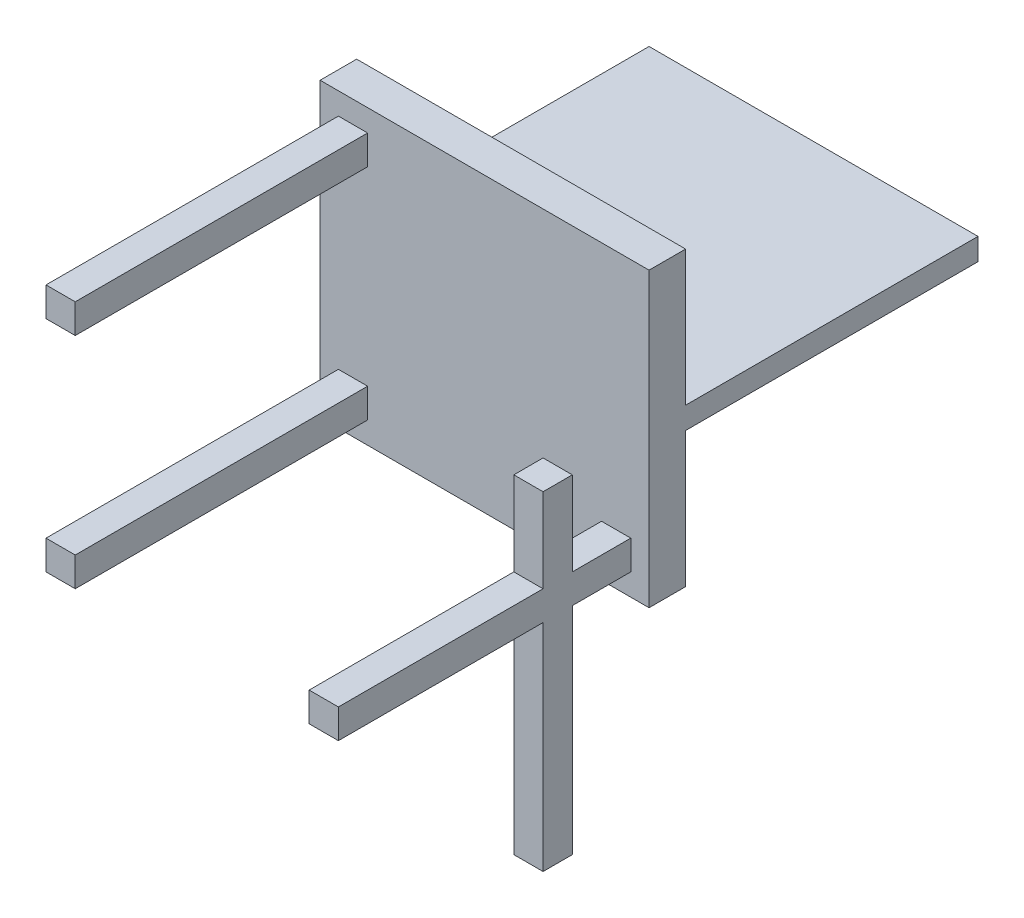
from build123d import *

# Parameters (mm, degrees)
SKETCH_1_W      = 450
SKETCH_1_H      = 400
EXTRUDE_1_DEPTH = 50
SKETCH_2_W      = 450
SKETCH_2_H      = 30
EXTRUDE_2_DEPTH = 400
SKETCH_3_W      = 40
SKETCH_3_H      = 40
EXTRUDE_3_DEPTH = 450
SKETCH_4_W      = 40
SKETCH_4_H      = 40
EXTRUDE_4_DEPTH = 450
SKETCH_5_W      = 40
SKETCH_5_H      = 40
EXTRUDE_5_DEPTH = 450
SKETCH_6_W      = 40
SKETCH_6_H      = 40
EXTRUDE_6_DEPTH = 450


with BuildPart() as part:
    # 草图1 → 凸台-拉伸1 (new body)
    with BuildSketch(Plane.XY):
        Rectangle(SKETCH_1_W, SKETCH_1_H)
    extrude(amount=EXTRUDE_1_DEPTH)

    # 草图2 → 凸台-拉伸2 (add)
    with BuildSketch(Plane(origin=(0, 0, 0), x_dir=(-1, 0, 0), z_dir=(0, 0, -1))):
        Rectangle(SKETCH_2_W, SKETCH_2_H)
    extrude(amount=EXTRUDE_2_DEPTH)

    # 草图4 → 凸台-拉伸4 (add)
    with BuildSketch(Plane.XY):
        with Locations((-180, 150)):
            Rectangle(SKETCH_4_W, SKETCH_4_H)
    extrude(amount=EXTRUDE_4_DEPTH)



with BuildPart() as body_2:
    # 草图3 → 凸台-拉伸3 (new body)
    with BuildSketch(Plane.XZ.offset(15)):
        with Locations((180, 150)):
            Rectangle(SKETCH_3_W, SKETCH_3_H)
    extrude(amount=EXTRUDE_3_DEPTH)


with BuildPart() as part_1:
    add(part.part)

    add(body_2.part)  # 凸台-拉伸5 merges body 2
    # 草图5 → 凸台-拉伸5 (add)
    with BuildSketch(Plane.XY):
        with Locations((180, -150)):
            Rectangle(SKETCH_5_W, SKETCH_5_H)
    extrude(amount=EXTRUDE_5_DEPTH)

    # 草图6 → 凸台-拉伸6 (add)
    with BuildSketch(Plane.XY):
        with Locations((-180, -150)):
            Rectangle(SKETCH_6_W, SKETCH_6_H)
    extrude(amount=EXTRUDE_6_DEPTH)


solid = part_1.part
